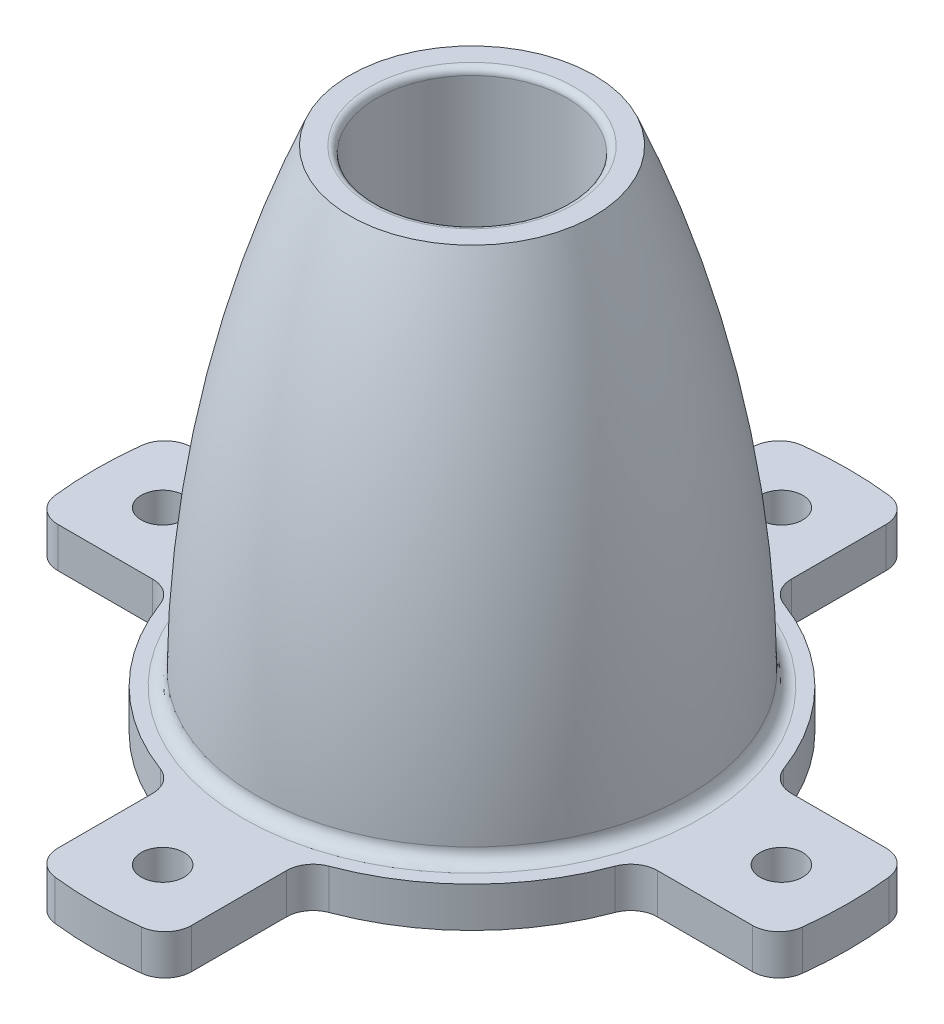
from build123d import *

# Parameters (mm, degrees)
CUT_EXTRUDE1_DEPTH = 25
CUT_EXTRUDE2_DEPTH = 22
SKETCH4_R          = 1.6
CUT_EXTRUDE3_DEPTH = 53.981423697
FILLET3_R          = 0.5
FILLET6_R          = 2
FILLET7_R          = 1


with BuildPart() as part:
    # Sketch1 → Revolve1 (revolve)
    with BuildSketch(Plane.XY, mode=Mode.PRIVATE) as revolve1_sk:
        with BuildLine():
            Line((-28.125, 0), (-28.125, 3))
            Line((-28.125, 3), (-16.125, 3))
            ThreePointArc((-16.125, 3), (-14.357841488, 20.846568298), (-9.125, 38))
            Line((-9.125, 38), (-7.125, 38))
            Line((-7.125, 38), (-7.125, 0))
            Line((-7.125, 0), (-28.125, 0))
        make_face()
    revolve(revolve1_sk.sketch.rotate(Axis((0, 0, 0), (0, 1, 0)), 270), axis=Axis((0, 0, 0), (0, 1, 0)))

    # Sketch2 → Cut-Extrude1 (cut)
    with BuildSketch(Plane.XZ):
        Polygon((0, 12.817175976), (-11.1, 6.408587988), (-11.1, -6.408587988), (0, -12.817175976), (11.1, -6.408587988), (11.1, 6.408587988), align=None)
    extrude(amount=-CUT_EXTRUDE1_DEPTH, mode=Mode.SUBTRACT)

    # Sketch3 → Cut-Extrude2 (cut)
    with BuildSketch(Plane(origin=(0, 3, 0), x_dir=(1, 0, 0), z_dir=(0, 1, 0))):
        with BuildLine():
            ThreePointArc((17.421699831, -5), (12.816310409, -12.816310409), (5, -17.421699831))
            Line((5, -17.421699831), (5, -27.676987282))
            ThreePointArc((5, -27.676987282), (19.887378221, -19.887378221), (27.676987282, -5))
            Line((27.676987282, -5), (17.421699831, -5))
        make_face()
        with BuildLine():
            Line((-5, -27.676987282), (-5, -17.421699831))
            ThreePointArc((-5, -17.421699831), (-12.816310409, -12.816310409), (-17.421699831, -5))
            Line((-17.421699831, -5), (-27.676987282, -5))
            ThreePointArc((-27.676987282, -5), (-19.887378221, -19.887378221), (-5, -27.676987282))
        make_face()
        with BuildLine():
            Line((-27.676987282, 5), (-17.421699831, 5))
            ThreePointArc((-17.421699831, 5), (-12.816310409, 12.816310409), (-5, 17.421699831))
            Line((-5, 17.421699831), (-5, 27.676987282))
            ThreePointArc((-5, 27.676987282), (-19.887378221, 19.887378221), (-27.676987282, 5))
        make_face()
        with BuildLine():
            ThreePointArc((5, 17.421699831), (12.816310409, 12.816310409), (17.421699831, 5))
            Line((17.421699831, 5), (27.676987282, 5))
            ThreePointArc((27.676987282, 5), (19.887378221, 19.887378221), (5, 27.676987282))
            Line((5, 27.676987282), (5, 17.421699831))
        make_face()
    extrude(amount=-CUT_EXTRUDE2_DEPTH, mode=Mode.SUBTRACT)

    # Sketch4 → Cut-Extrude3 (cut, through all)
    with BuildSketch(Plane(origin=(0, 3, 0), x_dir=(1, 0, 0), z_dir=(0, 1, 0))):
        with Locations(Location((23.125, 0, 0), (0, 0, 270))):
            Circle(SKETCH4_R)
        with Locations(Location((0, -23.125, 0), (0, 0, 270))):
            Circle(SKETCH4_R)
        with Locations(Location((-23.125, 0, 0), (0, 0, 270))):
            Circle(SKETCH4_R)
        with Locations(Location((0, 23.125, 0), (0, 0, 270))):
            Circle(SKETCH4_R)
    extrude(amount=-CUT_EXTRUDE3_DEPTH, mode=Mode.SUBTRACT)

    # Fillet3
    fillet3_edges = [part.edges().sort_by_distance(p)[0] for p in [
        (5.55, 25, 9.612881982),
        (11.1, 25, 0),
        (5.55, 25, -9.612881982),
        (-5.55, 25, -9.612881982),
        (-11.1, 25, 0),
        (-5.55, 25, 9.612881982),
        (0, 25, 7.125),
        (0, 38, 7.125),
    ]]
    fillet(fillet3_edges, radius=FILLET3_R)

    # Fillet6
    fillet6_edges = [part.edges().sort_by_distance(p)[0] for p in [
        (-17.421699831, 1.5, 5),
        (-5, 1.5, 17.421699831),
        (-5, 1.5, 27.676987282),
        (-27.676987282, 1.5, 5),
        (5, 1.5, 17.421699831),
        (17.421699831, 1.5, 5),
        (27.676987282, 1.5, 5),
        (5, 1.5, 27.676987282),
        (17.421699831, 1.5, -5),
        (5, 1.5, -17.421699831),
        (5, 1.5, -27.676987282),
        (27.676987282, 1.5, -5),
        (-5, 1.5, -17.421699831),
        (-17.421699831, 1.5, -5),
        (-27.676987282, 1.5, -5),
        (-5, 1.5, -27.676987282),
    ]]
    fillet(fillet6_edges, radius=FILLET6_R)

    # Fillet7
    fillet7_edges = [part.edges().sort_by_distance(p)[0] for p in [
        (0, 3, 16.125),
    ]]
    fillet(fillet7_edges, radius=FILLET7_R)


solid = part.part
